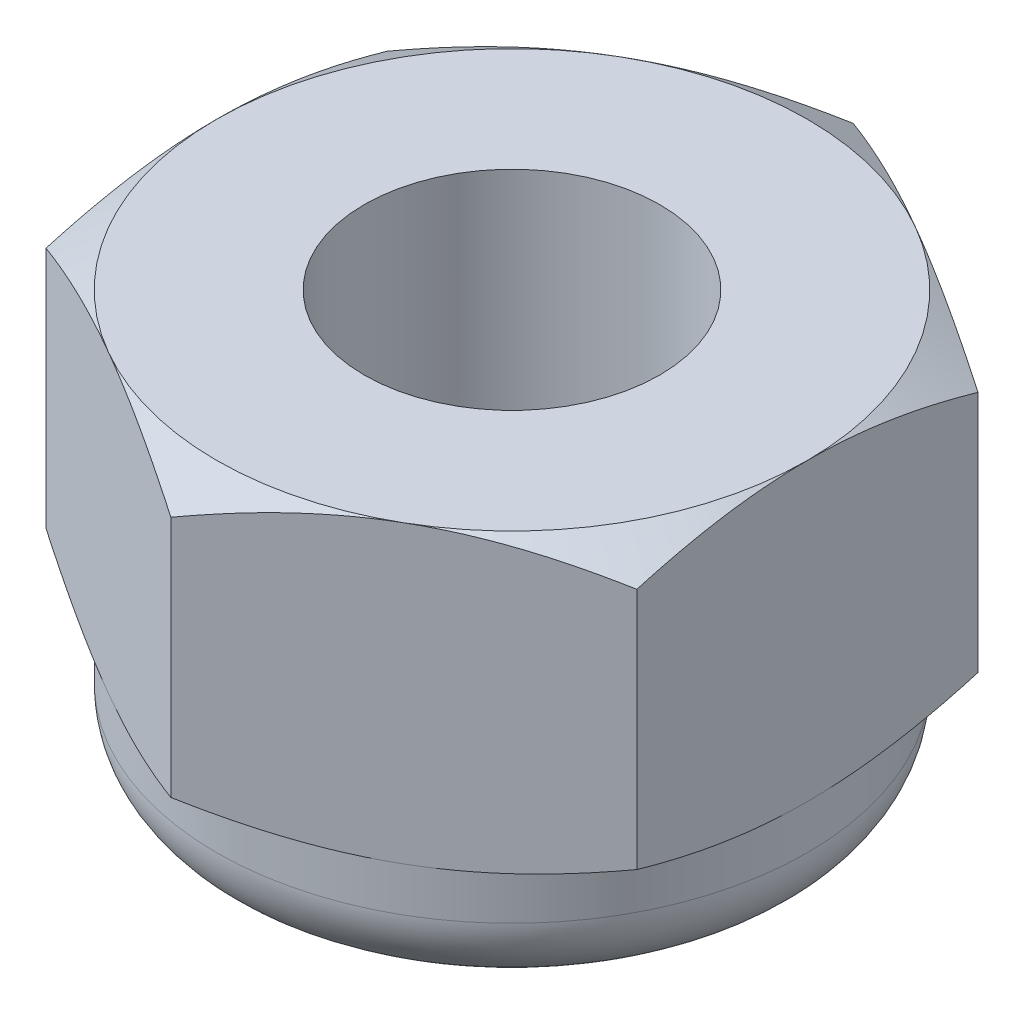
from build123d import *
from build123d.topology import SkipClean

# Parameters (mm, degrees)
SKETCH_1_R      = 1
EXTRUDE_2_DEPTH = 2
EXTRUDE_START   = 0.8
SKETCH_3_R      = 2
SKETCH_3_R_2    = 1
EXTRUDE_3_DEPTH = 0.8
FILLET_1_R      = 0.5


with BuildPart() as part:
    # 草图1 → 凸台-拉伸2 (new body)
    with BuildSketch(Plane(origin=(0, 0, 0), x_dir=(1, 0, 0), z_dir=(0, 1, 0))):
        Polygon((2, 1.154700538), (0, 2.309401077), (-2, 1.154700538), (-2, -1.154700538), (0, -2.309401077), (2, -1.154700538), align=None)
        with Locations(Location((0, 0, 0), (0, 0, 270))):
            Circle(SKETCH_1_R, mode=Mode.SUBTRACT)
    extrude(amount=EXTRUDE_2_DEPTH)

    # 草图2 → 切除-旋转1 (revolve, cut)
    with BuildSketch(Plane.XY):
        Polygon((3.732050808, 1), (2, 2), (3.732050808, 2), align=None)
        Polygon((2, 0), (3.732050808, 1), (3.732050808, 0), align=None)
    revolve(axis=Axis((0, 1.981363764, 0), (0, 1, 0)), mode=Mode.SUBTRACT)

    # 草图3 → 凸台-拉伸3 (add)
    with SkipClean():  # the faces are left unmerged after this step: merging them gives an invalid solid
        with BuildSketch(Plane.XZ.offset(EXTRUDE_START)):
            with Locations(Location((0, 0, 0), (0, 0, 60))):
                Circle(SKETCH_3_R)
            with Locations(Location((0, 0, 0), (0, 0, 270))):
                Circle(SKETCH_3_R_2, mode=Mode.SUBTRACT)
        extrude(amount=-EXTRUDE_3_DEPTH)

    # 圆角1
    fillet_1_edges = [part.edges().sort_by_distance(p)[0] for p in [
        (-1, -0.8, -1.732050808),
    ]]
    fillet(fillet_1_edges, radius=FILLET_1_R)


solid = part.part
